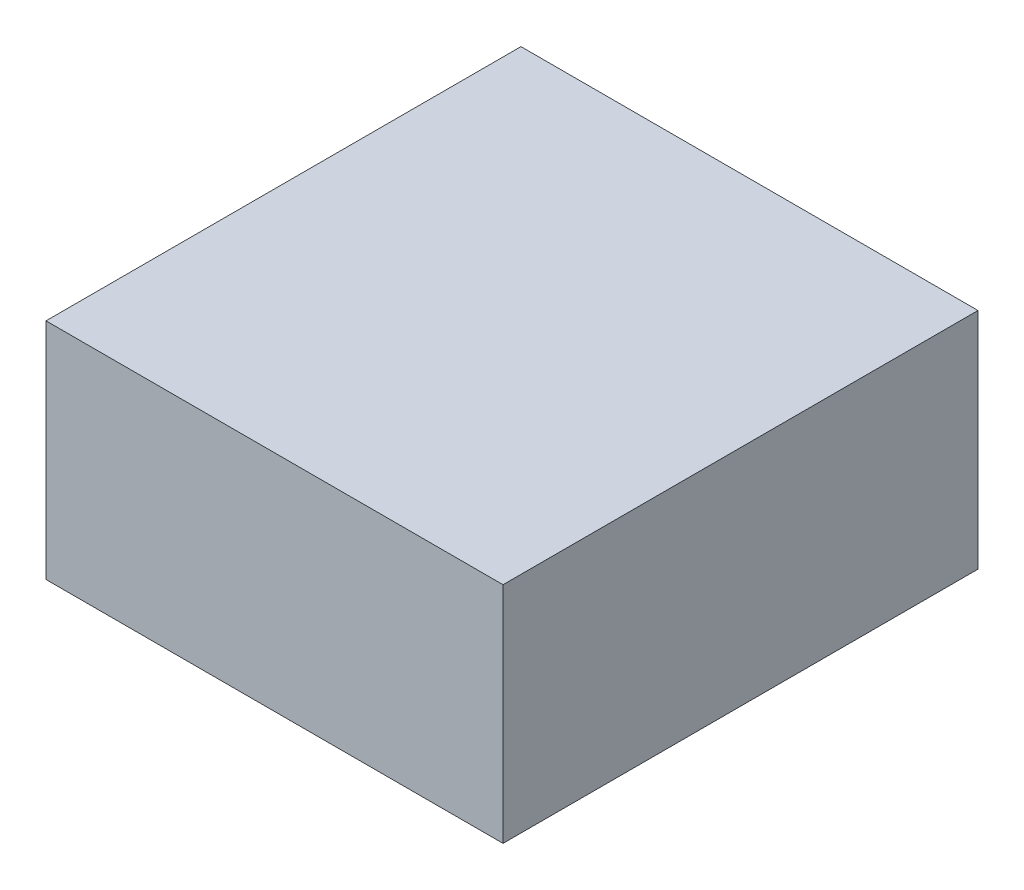
from build123d import *

# Parameters (mm, degrees)
ESQUISSE1_W        = 51
ESQUISSE1_H        = 53
BOSS_EXTRU_1_DEPTH = 25


with BuildPart() as part:
    # Esquisse1 → Boss.-Extru.1 (new body)
    with BuildSketch(Plane(origin=(0, 0, 0), x_dir=(1, 0, 0), z_dir=(0, 1, 0))):
        Rectangle(ESQUISSE1_W, ESQUISSE1_H)
    extrude(amount=BOSS_EXTRU_1_DEPTH)


solid = part.part
